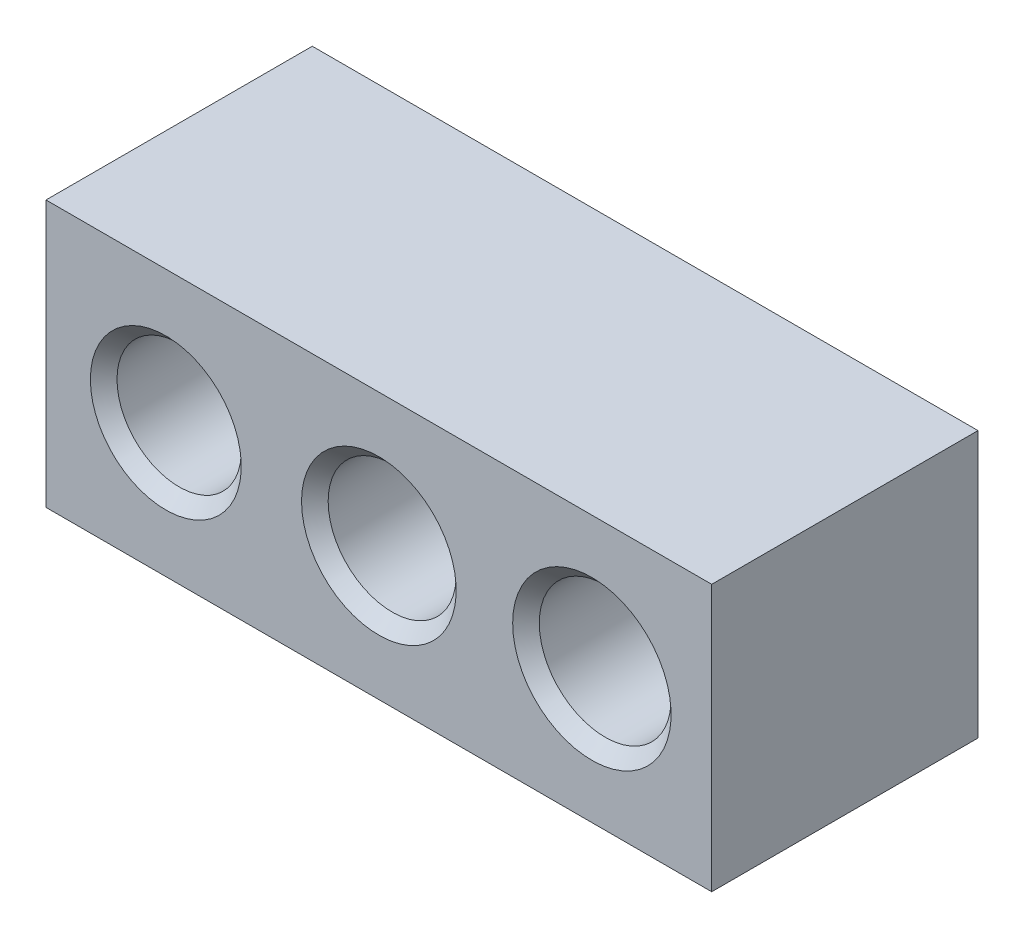
from build123d import *

# Parameters (mm, degrees)
SKETCH1_W           = 25
SKETCH1_H           = 10
SKETCH1_R           = 2.404163056
SKETCH1_R_2         = 2.333452378
SKETCH1_R_3         = 2.474873734
BOSS_EXTRUDE1_DEPTH = 10
CHAMFER1_SIZE       = 0.5


with BuildPart() as part:
    # Sketch1 → Boss-Extrude1 (new body)
    with BuildSketch(Plane.XY):
        Rectangle(SKETCH1_W, SKETCH1_H)
        Circle(SKETCH1_R, mode=Mode.SUBTRACT)
        with Locations((-8, 0)):
            Circle(SKETCH1_R_2, mode=Mode.SUBTRACT)
        with Locations((8, 0)):
            Circle(SKETCH1_R_3, mode=Mode.SUBTRACT)
    extrude(amount=BOSS_EXTRUDE1_DEPTH)

    # Chamfer1
    chamfer1_edges = [part.edges().sort_by_distance(p)[0] for p in [
        (-2.404163056, 0, 10),
        (5.525126266, 0, 10),
        (-10.333452378, 0, 10),
    ]]
    chamfer(chamfer1_edges, length=CHAMFER1_SIZE)


solid = part.part
